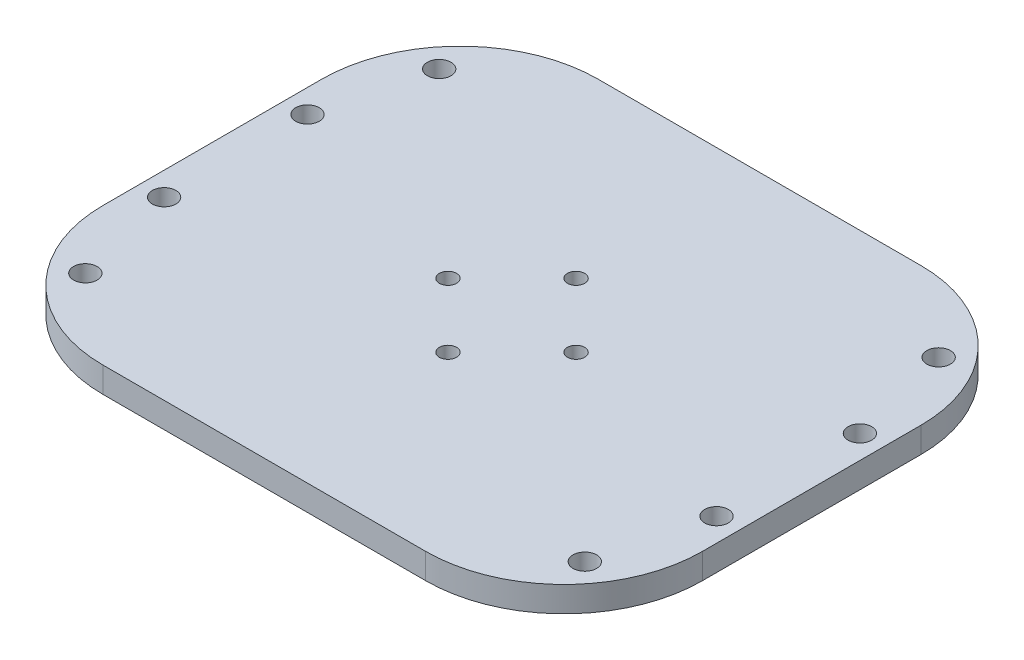
from build123d import *

# Parameters (mm, degrees)
BOSS_EXTRUDE1_DEPTH   = 3.175
F_4_CLEARANCE_HOLE1_D = 2.159
F_4_CLEARANCE_HOLE2_D = 2.9464


with BuildPart() as part:
    # Sketch1 → Boss-Extrude1 (new body)
    with BuildSketch(Plane(origin=(0, 0, 0), x_dir=(1, 0, 0), z_dir=(0, 1, 0))):
        with BuildLine():
            Line((20.150112608, -30.9245), (-20.150112608, -30.9245))
            ThreePointArc((-20.150112608, -30.9245), (-32.36664613, -25.86424613), (-37.4269, -13.647712608))
            Line((-37.4269, -13.647712608), (-37.4269, 13.647712608))
            ThreePointArc((-37.4269, 13.647712608), (-32.36664613, 25.86424613), (-20.150112608, 30.9245))
            Line((-20.150112608, 30.9245), (20.150112608, 30.9245))
            ThreePointArc((20.150112608, 30.9245), (32.36664613, 25.86424613), (37.4269, 13.647712608))
            Line((37.4269, 13.647712608), (37.4269, -13.647712608))
            ThreePointArc((37.4269, -13.647712608), (32.36664613, -25.86424613), (20.150112608, -30.9245))
        make_face()
    extrude(amount=BOSS_EXTRUDE1_DEPTH)

    # #4 Clearance Hole1 (through all)
    with Locations(Plane(origin=(0, 3.175, 0), x_dir=(-1, 0, 0), z_dir=(0, 1, 0))):
        with Locations((0, -8), (-8, 0), (0, 8), (8, 0)):
            Hole(F_4_CLEARANCE_HOLE1_D / 2)

    # #4 Clearance Hole2 (through all)
    with Locations(Plane(origin=(0, 3.175, 0), x_dir=(-1, 0, 0), z_dir=(0, 1, 0))):
        with Locations((31.1912, -22.098), (-31.1912, -22.098), (-31.1912, 22.098), (31.1912, 22.098), (34.5, -8.9535), (34.5, 8.9535), (-34.5, 8.9535), (-34.5, -8.9535)):
            Hole(F_4_CLEARANCE_HOLE2_D / 2)


solid = part.part
